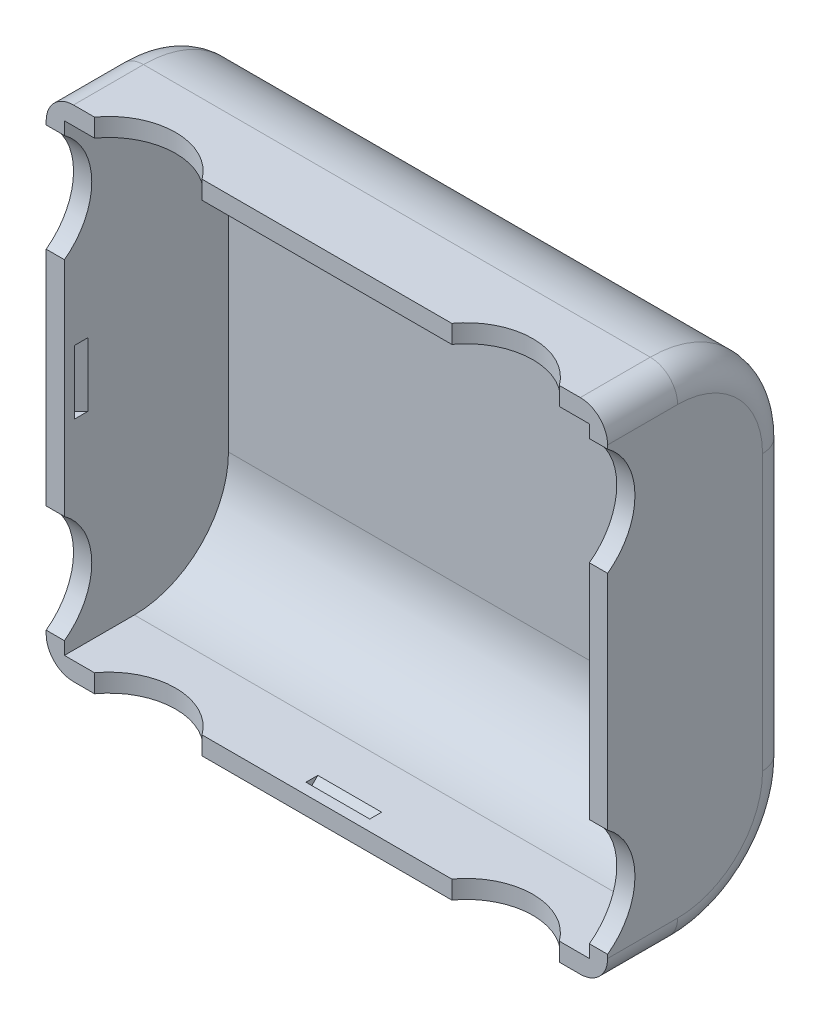
from build123d import *

# Parameters (mm, degrees)
EXTRUDE_1_DEPTH      = 61.6
SHELL_1_T            = -2
CUT_EXTRUDE_8_DEPTH  = 3.5
CUT_EXTRUDE_9_REACH  = 80.817
CUT_EXTRUDE_10_REACH = 80.817
CUT_EXTRUDE_11_REACH = 86.711
CUT_EXTRUDE_12_REACH = 86.711
CUT_EXTRUDE_13_DEPTH = 3.5
FILLET_1_R           = 3
FILLET_2_R           = 3


with BuildPart() as part:
    # ｽｹｯﾁ2 → ﾎﾞｽ - 押し出し1 (new body)
    with BuildSketch(Plane(origin=(0, 0, 0), x_dir=(0, 0, -1), z_dir=(1, 0, 0))):
        with BuildLine():
            Line((7.125790142, 45.158487371), (-0.55, 45.158487371))
            Line((-0.55, 45.158487371), (-0.55, -9.641512629))
            Line((-0.55, -9.641512629), (7.125790142, -9.641512629))
            ThreePointArc((7.125790142, -9.641512629), (15.840322505, -6.031835134), (19.45, 2.682697229))
            Line((19.45, 2.682697229), (19.45, 32.834277513))
            ThreePointArc((19.45, 32.834277513), (15.840322505, 41.548809876), (7.125790142, 45.158487371))
        make_face()
    extrude(amount=EXTRUDE_1_DEPTH)

    # ｼｪﾙ1
    shell_1_openings = [part.faces().sort_by_distance(p)[0] for p in [
        (30.8, 17.758487371, 0.55),
    ]]
    offset(amount=SHELL_1_T, openings=shell_1_openings, kind=Kind.INTERSECTION)

    # ｽｹｯﾁ11 → ｶｯﾄ - 押し出し8 (cut, symmetric)
    with BuildSketch(Plane(origin=(0, 17.758487371, 0), x_dir=(1, 0, 0), z_dir=(0, 1, 0))):
        Polygon((2.16, 2.171540251), (1.251335836, 1.262876087), (1.251335836, 0.566601917), (2.16, 0.566601917), align=None)
        Polygon((59.44, 2.171540251), (59.44, 0.566601917), (60.348664164, 0.566601917), (60.348664164, 1.262876087), align=None)
    extrude(amount=CUT_EXTRUDE_8_DEPTH, both=True, mode=Mode.SUBTRACT)

    # ｽｹｯﾁ12 → ｶｯﾄ - 押し出し9 (cut, up to next)
    with BuildSketch(Plane(origin=(61.6, 0, 0), x_dir=(0, 0, -1), z_dir=(1, 0, 0)), mode=Mode.PRIVATE) as cut_extrude_9_sk1:
        with BuildLine():
            Line((-0.55, 41.757639853), (-0.55, 29.95933489))
            ThreePointArc((-0.55, 29.95933489), (2.45, 35.858487371), (-0.55, 41.757639853))
        make_face()
    cut_extrude_9_tool1 = extrude(cut_extrude_9_sk1.sketch, amount=-CUT_EXTRUDE_9_REACH, mode=Mode.PRIVATE) & part.part
    # ｽｹｯﾁ12 → ｶｯﾄ - 押し出し9 (cut, up to next)
    with BuildSketch(Plane(origin=(61.6, 0, 0), x_dir=(0, 0, -1), z_dir=(1, 0, 0)), mode=Mode.PRIVATE) as cut_extrude_9_sk2:
        with BuildLine():
            Line((-0.55, 5.557639853), (-0.55, -6.24066511))
            ThreePointArc((-0.55, -6.24066511), (2.45, -0.341512629), (-0.55, 5.557639853))
        make_face()
    cut_extrude_9_tool2 = extrude(cut_extrude_9_sk2.sketch, amount=-CUT_EXTRUDE_9_REACH, mode=Mode.PRIVATE) & part.part
    add(cut_extrude_9_tool1.solids().sort_by_distance((61.6, 35.858487, -0.674015))[0], mode=Mode.SUBTRACT)
    add(cut_extrude_9_tool2.solids().sort_by_distance((61.6, -0.341513, -0.674015))[0], mode=Mode.SUBTRACT)

    # ｽｹｯﾁ13 → ｶｯﾄ - 押し出し10 (cut, up to next)
    with BuildSketch(Plane.ZY, mode=Mode.PRIVATE) as cut_extrude_10_sk1:
        with BuildLine():
            Line((0.55, 29.95933489), (0.55, 41.757639853))
            ThreePointArc((0.55, 41.757639853), (-2.45, 35.858487371), (0.55, 29.95933489))
        make_face()
    cut_extrude_10_tool1 = extrude(cut_extrude_10_sk1.sketch, amount=-CUT_EXTRUDE_10_REACH, mode=Mode.PRIVATE) & part.part
    # ｽｹｯﾁ13 → ｶｯﾄ - 押し出し10 (cut, up to next)
    with BuildSketch(Plane.ZY, mode=Mode.PRIVATE) as cut_extrude_10_sk2:
        with BuildLine():
            Line((0.55, -6.24066511), (0.55, 5.557639853))
            ThreePointArc((0.55, 5.557639853), (-2.45, -0.341512629), (0.55, -6.24066511))
        make_face()
    cut_extrude_10_tool2 = extrude(cut_extrude_10_sk2.sketch, amount=-CUT_EXTRUDE_10_REACH, mode=Mode.PRIVATE) & part.part
    add(cut_extrude_10_tool1.solids().sort_by_distance((0, 35.858487, -0.674015))[0], mode=Mode.SUBTRACT)
    add(cut_extrude_10_tool2.solids().sort_by_distance((0, -0.341513, -0.674015))[0], mode=Mode.SUBTRACT)

    # ｽｹｯﾁ14 → ｶｯﾄ - 押し出し11 (cut, up to next)
    with BuildSketch(Plane.XZ.offset(9.641512629), mode=Mode.PRIVATE) as cut_extrude_11_sk1:
        with BuildLine():
            Line((5.300847518, 0.55), (17.099152482, 0.55))
            ThreePointArc((17.099152482, 0.55), (11.2, -2.45), (5.300847518, 0.55))
        make_face()
    cut_extrude_11_tool1 = extrude(cut_extrude_11_sk1.sketch, amount=-CUT_EXTRUDE_11_REACH, mode=Mode.PRIVATE) & part.part
    # ｽｹｯﾁ14 → ｶｯﾄ - 押し出し11 (cut, up to next)
    with BuildSketch(Plane.XZ.offset(9.641512629), mode=Mode.PRIVATE) as cut_extrude_11_sk2:
        with BuildLine():
            Line((44.500847518, 0.55), (56.299152482, 0.55))
            ThreePointArc((56.299152482, 0.55), (50.4, -2.45), (44.500847518, 0.55))
        make_face()
    cut_extrude_11_tool2 = extrude(cut_extrude_11_sk2.sketch, amount=-CUT_EXTRUDE_11_REACH, mode=Mode.PRIVATE) & part.part
    add(cut_extrude_11_tool1.solids().sort_by_distance((11.2, -9.641513, -0.674015))[0], mode=Mode.SUBTRACT)
    add(cut_extrude_11_tool2.solids().sort_by_distance((50.4, -9.641513, -0.674015))[0], mode=Mode.SUBTRACT)

    # ｽｹｯﾁ15 → ｶｯﾄ - 押し出し12 (cut, up to next)
    with BuildSketch(Plane(origin=(0, 45.158487371, 0), x_dir=(1, 0, 0), z_dir=(0, 1, 0)), mode=Mode.PRIVATE) as cut_extrude_12_sk1:
        with BuildLine():
            Line((44.500847518, -0.55), (56.299152482, -0.55))
            ThreePointArc((56.299152482, -0.55), (50.4, 2.45), (44.500847518, -0.55))
        make_face()
    cut_extrude_12_tool1 = extrude(cut_extrude_12_sk1.sketch, amount=-CUT_EXTRUDE_12_REACH, mode=Mode.PRIVATE) & part.part
    # ｽｹｯﾁ15 → ｶｯﾄ - 押し出し12 (cut, up to next)
    with BuildSketch(Plane(origin=(0, 45.158487371, 0), x_dir=(1, 0, 0), z_dir=(0, 1, 0)), mode=Mode.PRIVATE) as cut_extrude_12_sk2:
        with BuildLine():
            Line((5.300847518, -0.55), (17.099152482, -0.55))
            ThreePointArc((17.099152482, -0.55), (11.2, 2.45), (5.300847518, -0.55))
        make_face()
    cut_extrude_12_tool2 = extrude(cut_extrude_12_sk2.sketch, amount=-CUT_EXTRUDE_12_REACH, mode=Mode.PRIVATE) & part.part
    add(cut_extrude_12_tool1.solids().sort_by_distance((50.4, 45.158487, -0.674015))[0], mode=Mode.SUBTRACT)
    add(cut_extrude_12_tool2.solids().sort_by_distance((11.2, 45.158487, -0.674015))[0], mode=Mode.SUBTRACT)

    # ｽｹｯﾁ16 → ｶｯﾄ - 押し出し13 (cut, symmetric)
    with BuildSketch(Plane(origin=(30.8, 0, 0), x_dir=(0, 0, -1), z_dir=(1, 0, 0))):
        Polygon((2.051421356, 43.058487371), (0.651335836, 43.058487371), (0.651335836, 43.847151535), (1.262757192, 43.847151535), align=None)
        Polygon((1.262757192, -8.330176793), (2.051421356, -7.541512629), (0.651335836, -7.541512629), (0.651335836, -8.330176793), align=None)
    extrude(amount=CUT_EXTRUDE_13_DEPTH, both=True, mode=Mode.SUBTRACT)

    # ﾌｨﾚｯﾄ1
    fillet_1_edges = [part.edges().sort_by_distance(p)[0] for p in [
        (61.6, -6.031835134, -15.840322505),
        (61.6, 17.758487371, -19.45),
        (61.6, 41.548809876, -15.840322505),
        (61.6, 45.158487371, -3.287895071),
        (61.6, -9.641512629, -3.287895071),
    ]]
    fillet(fillet_1_edges, radius=FILLET_1_R)

    # ﾌｨﾚｯﾄ2
    fillet_2_edges = [part.edges().sort_by_distance(p)[0] for p in [
        (0, 45.158487371, -3.287895071),
        (0, 41.548809876, -15.840322505),
        (0, 17.758487371, -19.45),
        (0, -6.031835134, -15.840322505),
        (0, -9.641512629, -3.287895071),
    ]]
    fillet(fillet_2_edges, radius=FILLET_2_R)


solid = part.part
